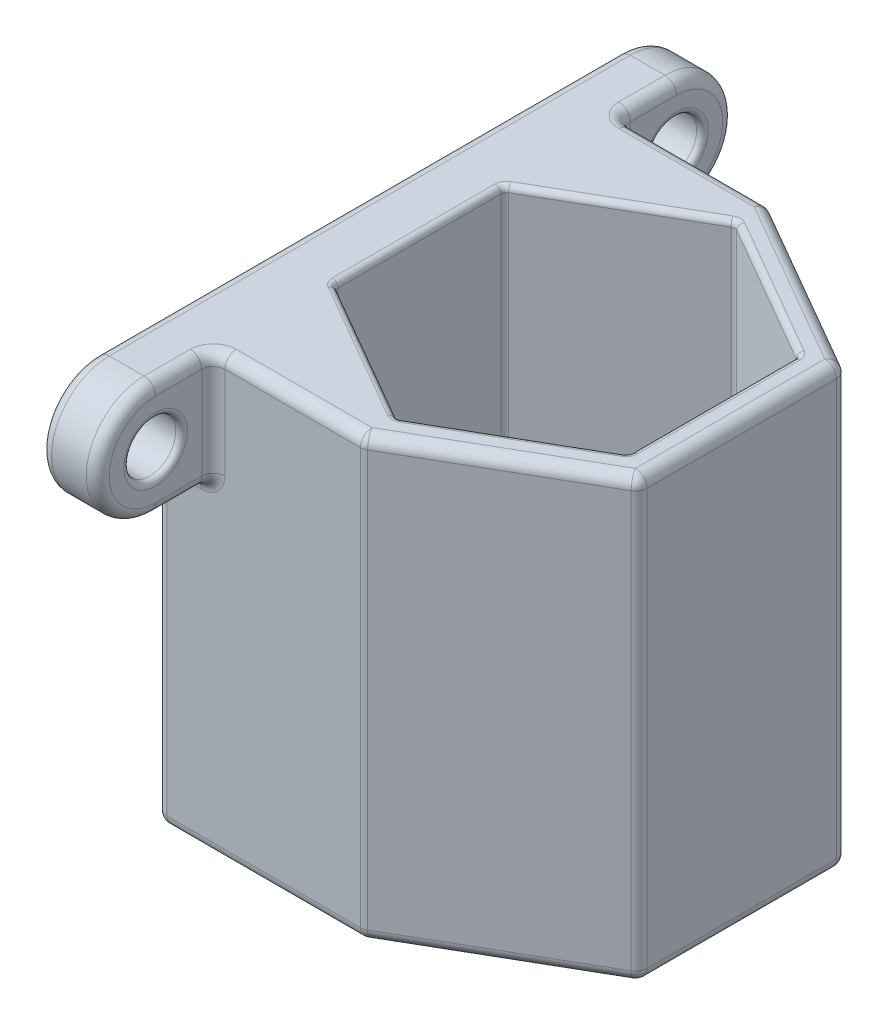
from build123d import *

# Parameters (mm, degrees)
BOSS_EXTRUDE1_DEPTH = 25
BOSS_EXTRUDE2_DEPTH = 2.5
BOSS_EXTRUDE3_DEPTH = 8
BOSS_EXTRUDE4_DEPTH = 2.5
SKETCH5_R           = 3.25
CUT_EXTRUDE1_DEPTH  = 45.531936106
BOSS_EXTRUDE5_DEPTH = 38
SKETCH7_R           = 5
SKETCH7_R_2         = 2.25
BOSS_EXTRUDE6_DEPTH = 5
SKETCH8_R           = 3.25
BOSS_EXTRUDE7_DEPTH = 0.2
FILLET1_R           = 0.5
FILLET2_R           = 1
FILLET3_R           = 0.5


with BuildPart() as part:
    # Sketch1 → Boss-Extrude1 (new body)
    with BuildSketch(Plane(origin=(0, 0, 0), x_dir=(1, 0, 0), z_dir=(0, 1, 0))):
        Polygon((15.2, -8.775724092), (15.2, 8.775724092), (0, 17.551448183), (-15.2, 8.775724092), (-15.2, -8.775724092), (0, -17.551448183), align=None)
        Polygon((0, -14.664696837), (12.7, -7.332348419), (12.7, 7.332348419), (0, 14.664696837), (-12.7, 7.332348419), (-12.7, -7.332348419), align=None, mode=Mode.SUBTRACT)
    extrude(amount=BOSS_EXTRUDE1_DEPTH)

    # Sketch2 → Boss-Extrude2 (add)
    with BuildSketch(Plane.XZ):
        Polygon((0, -17.551448183), (15.2, -8.775724092), (15.2, 8.775724092), (0, 17.551448183), (-15.2, 8.775724092), (-15.2, -8.775724092), align=None)
    extrude(amount=BOSS_EXTRUDE2_DEPTH)

    # Sketch3 → Boss-Extrude3 (add)
    with BuildSketch(Plane.XZ.offset(2.5)):
        Polygon((0, -17.551448183), (15.2, -8.775724092), (15.2, 8.775724092), (0, 17.551448183), (-15.2, 8.775724092), (-15.2, -8.775724092), align=None)
        Polygon((0, -5.773502692), (5, -2.886751346), (5, 2.886751346), (0, 5.773502692), (-5, 2.886751346), (-5, -2.886751346), align=None, mode=Mode.SUBTRACT)
    extrude(amount=BOSS_EXTRUDE3_DEPTH)

    # Sketch4 → Boss-Extrude4 (add)
    with BuildSketch(Plane.XZ.offset(10.5)):
        Polygon((0, -17.551448183), (15.2, -8.775724092), (15.2, 8.775724092), (0, 17.551448183), (-15.2, 8.775724092), (-15.2, -8.775724092), align=None)
    extrude(amount=BOSS_EXTRUDE4_DEPTH)

    # Sketch5 → Cut-Extrude1 (cut, through all)
    with BuildSketch(Plane.XZ.offset(13)):
        with Locations(Location((0, 0, 0), (0, 0, 270))):
            Circle(SKETCH5_R)
    extrude(amount=-CUT_EXTRUDE1_DEPTH, mode=Mode.SUBTRACT)

    # Sketch6 → Boss-Extrude5 (add)
    with BuildSketch(Plane.XZ.offset(13)):
        Polygon((0, 17.551448183), (-18, 17.551448183), (-18, -17.551448183), (0, -17.551448183), (-15.2, -8.775724092), (-15.2, 8.775724092), align=None)
    extrude(amount=-BOSS_EXTRUDE5_DEPTH)

    # Sketch7 → Boss-Extrude6 (add)
    # profile 1 of 6: a face of its own
    with BuildSketch(Plane.ZY.offset(18)):
        with BuildLine():
            Line((-17.551448183, 25), (-22.551448183, 25))
            ThreePointArc((-22.551448183, 25), (-19.015914277, 23.535533906), (-17.551448183, 20))
            Line((-17.551448183, 20), (-17.551448183, 25))
        make_face()
    # profile 2 of 6: a face of its own
    with BuildSketch(Plane.ZY.offset(18)):
        with BuildLine():
            Line((-17.551448183, 15), (-17.551448183, 20))
            ThreePointArc((-17.551448183, 20), (-19.015914277, 16.464466094), (-22.551448183, 15))
            Line((-22.551448183, 15), (-17.551448183, 15))
        make_face()
    # profile 3 of 6: a face of its own
    with BuildSketch(Plane.ZY.offset(18)):
        with Locations((-22.551448183, 20)):
            Circle(SKETCH7_R)
        with Locations((-22.551448183, 20)):
            Circle(SKETCH7_R_2, mode=Mode.SUBTRACT)
    # profile 4 of 6: a face of its own
    with BuildSketch(Plane.ZY.offset(18)):
        with Locations((22.551448183, 20)):
            Circle(SKETCH7_R)
        with Locations((22.551448183, 20)):
            Circle(SKETCH7_R_2, mode=Mode.SUBTRACT)
    # profile 5 of 6: a face of its own
    with BuildSketch(Plane.ZY.offset(18)):
        with BuildLine():
            ThreePointArc((22.551448183, 15), (19.015914277, 16.464466094), (17.551448183, 20))
            Line((17.551448183, 20), (17.551448183, 15))
            Line((17.551448183, 15), (22.551448183, 15))
        make_face()
    # profile 6 of 6: a face of its own
    with BuildSketch(Plane.ZY.offset(18)):
        with BuildLine():
            Line((22.551448183, 25), (17.551448183, 25))
            Line((17.551448183, 25), (17.551448183, 20))
            ThreePointArc((17.551448183, 20), (19.015914277, 23.535533906), (22.551448183, 25))
        make_face()
    extrude(amount=-BOSS_EXTRUDE6_DEPTH)

    # Sketch8 → Boss-Extrude7 (add)
    with BuildSketch(Plane.XZ.offset(2.5)):
        with Locations(Location((0, 0, 0), (0, 0, 270))):
            Circle(SKETCH8_R)
    extrude(amount=-BOSS_EXTRUDE7_DEPTH)

    # Fillet1
    fillet1_edges = [part.edges().sort_by_distance(p)[0] for p in [
        (0, 0, 3.25),
        (-6.35, 0, 10.998522628),
        (-12.7, 12.5, 7.332348419),
        (6.35, 0, 10.998522628),
        (0, 12.5, 14.664696837),
        (12.7, 0, 0),
        (12.7, 12.5, 7.332348419),
        (6.35, 0, -10.998522628),
        (12.7, 12.5, -7.332348419),
        (-6.35, 0, -10.998522628),
        (0, 12.5, -14.664696837),
        (-12.7, 0, 0),
        (-12.7, 12.5, -7.332348419),
        (-6.35, 25, 10.998522628),
        (6.35, 25, 10.998522628),
        (12.7, 25, 0),
        (6.35, 25, -10.998522628),
        (-6.35, 25, -10.998522628),
        (-12.7, 25, 0),
    ]]
    fillet(fillet1_edges, radius=FILLET1_R)

    # Fillet2
    fillet2_edges = [part.edges().sort_by_distance(p)[0] for p in [
        (0, 6, 17.551448183),
        (0, 6, -17.551448183),
        (15.2, 6, -8.775724092),
        (15.2, 6, 8.775724092),
        (7.6, 25, -13.163586138),
        (-9, -13, 17.551448183),
        (-18, -13, 0),
        (-9, -13, -17.551448183),
        (-6.5, 25, 17.551448183),
        (-18, 25, 0),
        (-18, 1, -17.551448183),
        (-6.5, 25, -17.551448183),
        (-13, 15, -20.051448183),
        (-15.5, 15, -17.551448183),
        (-13, 20, -27.551448183),
        (-13, 25, -20.051448183),
        (-13, 20, -17.551448183),
        (-18, 20, -27.551448183),
        (-18, 15, -20.051448183),
        (-18, 1, 17.551448183),
        (-13, 20, 27.551448183),
        (-13, 15, 20.051448183),
        (-15.5, 15, 17.551448183),
        (-13, 20, 17.551448183),
        (-13, 25, 20.051448183),
        (-18, 20, 27.551448183),
        (-18, 15, 20.051448183),
        (7.6, 25, 13.163586138),
        (15.2, 25, 0),
        (7.6, -13, -13.163586138),
        (15.2, -13, 0),
        (7.6, -13, 13.163586138),
    ]]
    fillet(fillet2_edges, radius=FILLET2_R)

    # Fillet3
    fillet3_edges = [part.edges().sort_by_distance(p)[0] for p in [
        (0, -10.5, 3.25),
        (0, -13, 3.25),
        (-18, 20, -24.801448183),
        (-13, 20, -24.801448183),
        (-18, 20, 20.301448183),
        (-13, 20, 20.301448183),
    ]]
    fillet(fillet3_edges, radius=FILLET3_R)


solid = part.part
